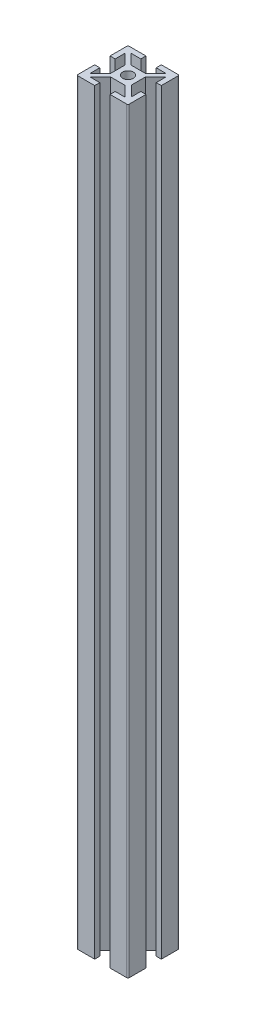
from build123d import *

# Parameters (mm, degrees)
SKETCH1_R           = 2.1
BOSS_EXTRUDE1_DEPTH = 295


with BuildPart() as part:
    # Sketch1 → Boss-Extrude1 (new body)
    with BuildSketch(Plane(origin=(0, 295, 0), x_dir=(1, 0, 0), z_dir=(0, 1, 0))):
        with BuildLine():
            Line((4, 2.746364236), (8, 6.746364236))
            Line((8, 6.746364236), (8, 3))
            Line((8, 3), (10, 3))
            Line((10, 3), (10, 9.5))
            ThreePointArc((10, 9.5), (9.853553391, 9.853553391), (9.5, 10))
            Line((9.5, 10), (3, 10))
            Line((3, 10), (3, 8))
            Line((3, 8), (6.863334179, 8))
            Line((6.863334179, 8), (2.863334179, 4))
            Line((2.863334179, 4), (-2.75, 4))
            Line((-2.75, 4), (-6.75, 8))
            Line((-6.75, 8), (-3, 8))
            Line((-3, 8), (-3, 10))
            Line((-3, 10), (-9.5, 10))
            ThreePointArc((-9.5, 10), (-9.853553391, 9.853553391), (-10, 9.5))
            Line((-10, 9.5), (-10, 3))
            Line((-10, 3), (-8, 3))
            Line((-8, 3), (-8, 6.75))
            Line((-8, 6.75), (-4, 2.75))
            Line((-4, 2.75), (-4, -2.75))
            Line((-4, -2.75), (-8, -6.75))
            Line((-8, -6.75), (-8, -3))
            Line((-8, -3), (-10, -3))
            Line((-10, -3), (-10, -9.5))
            ThreePointArc((-10, -9.5), (-9.853553391, -9.853553391), (-9.5, -10))
            Line((-9.5, -10), (-3, -10))
            Line((-3, -10), (-3, -8))
            Line((-3, -8), (-6.75, -8))
            Line((-6.75, -8), (-2.75, -4))
            Line((-2.75, -4), (2.868469119, -4))
            Line((2.868469119, -4), (6.868469119, -8))
            Line((6.868469119, -8), (3, -8))
            Line((3, -8), (3, -10))
            Line((3, -10), (9.5, -10))
            ThreePointArc((9.5, -10), (9.853553391, -9.853553391), (10, -9.5))
            Line((10, -9.5), (10, -3))
            Line((10, -3), (8, -3))
            Line((8, -3), (8, -6.665189266))
            Line((8, -6.665189266), (4, -2.665189266))
            Line((4, -2.665189266), (4, 2.746364236))
        make_face()
        with Locations(Location((0, 0, 0), (0, 0, 90))):
            Circle(SKETCH1_R, mode=Mode.SUBTRACT)
    extrude(amount=-BOSS_EXTRUDE1_DEPTH)


solid = part.part
